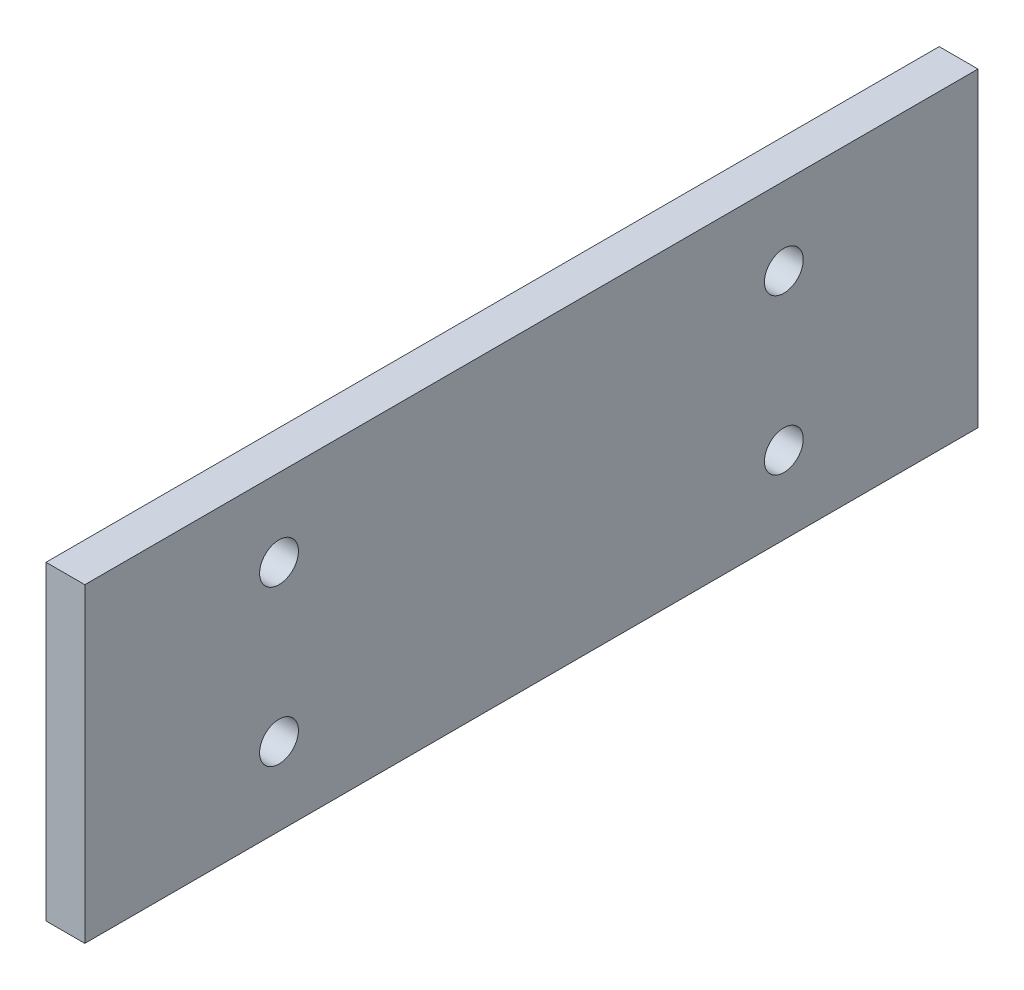
from build123d import *

# Parameters (mm, degrees)
IZIM1_W                     = 115
IZIM1_H                     = 40
IZIM1_R                     = 2.5
Y_KSEKLIK_EKSTR_ZYON1_DEPTH = 5


with BuildPart() as part:
    # Çizim1 → Yükseklik-Ekstrüzyon1 (new body)
    with BuildSketch(Plane(origin=(0, 0, 0), x_dir=(0, 0, -1), z_dir=(1, 0, 0))):
        with Locations((-57.5, 20)):
            Rectangle(IZIM1_W, IZIM1_H)
        with Locations((-90, 30)):
            Circle(IZIM1_R, mode=Mode.SUBTRACT)
        with Locations((-90, 10)):
            Circle(IZIM1_R, mode=Mode.SUBTRACT)
        with Locations(Location((-25, 10, 0), (0, 0, 180))):
            Circle(IZIM1_R, mode=Mode.SUBTRACT)
        with Locations(Location((-25, 30, 0), (0, 0, 180))):
            Circle(IZIM1_R, mode=Mode.SUBTRACT)
    extrude(amount=Y_KSEKLIK_EKSTR_ZYON1_DEPTH)


solid = part.part
